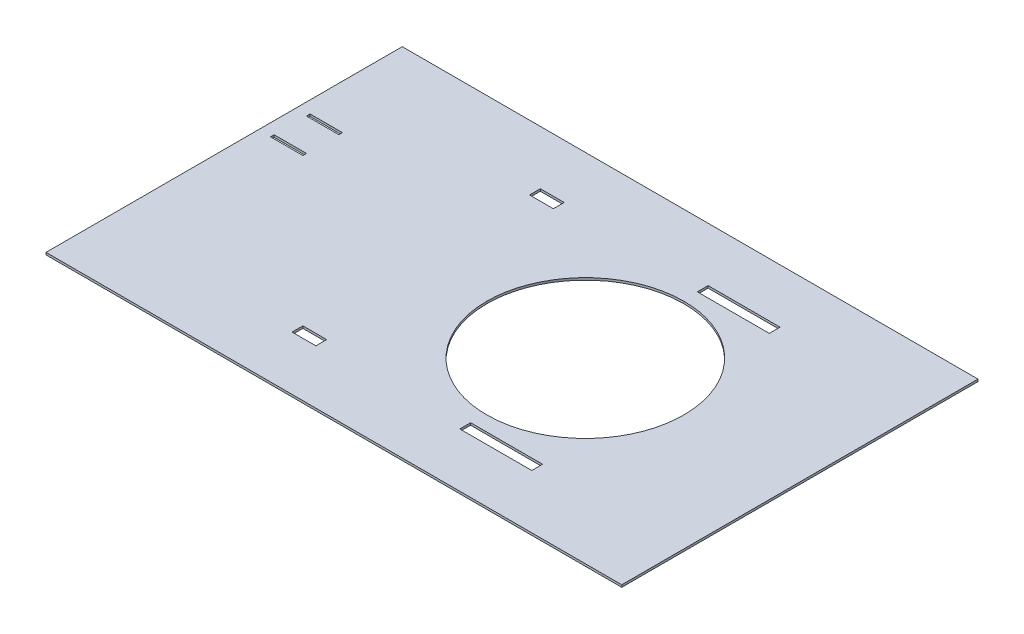
from build123d import *

# Parameters (mm, degrees)
SKETCH1_W           = 774.4075
SKETCH1_H           = 479.1612
SKETCH1_W_2         = 96.8014
SKETCH1_H_2         = 14.5217
SKETCH1_W_3         = 32.0431
SKETCH1_W_4         = 43.5651
SKETCH1_H_3         = 4.8406
SKETCH1_H_4         = 4.8439
SKETCH1_W_5         = 96.7997
BOSS_EXTRUDE1_DEPTH = 3


with BuildPart() as part:
    # Sketch1 → Boss-Extrude1 (new body)
    with BuildSketch(Plane(origin=(0, 0, 0), x_dir=(1, 0, 0), z_dir=(0, 1, 0))):
        Rectangle(SKETCH1_W, SKETCH1_H)
        with Locations((145.20205, -159.71625)):
            Rectangle(SKETCH1_W_2, SKETCH1_H_2, mode=Mode.SUBTRACT)
        with Locations((-112.8262, 159.71955)):
            Rectangle(SKETCH1_W_3, SKETCH1_H_2, mode=Mode.SUBTRACT)
        with Locations((-112.8262, -159.71625)):
            Rectangle(SKETCH1_W_3, SKETCH1_H_2, mode=Mode.SUBTRACT)
        with Locations((-349.0636, 96.8089)):
            Rectangle(SKETCH1_W_4, SKETCH1_H_3, mode=Mode.SUBTRACT)
        with Locations((-349.0636, 48.40155)):
            Rectangle(SKETCH1_W_4, SKETCH1_H_4, mode=Mode.SUBTRACT)
        with Locations((145.1962, 159.71955)):
            Rectangle(SKETCH1_W_5, SKETCH1_H_2, mode=Mode.SUBTRACT)
        with BuildLine():
            add(Edge.make_bspline(
                [(231.14055, 0.003500004), (231.14055, 73.1819), (171.81845, 132.5041), (98.64075, 132.5042)],
                knots=[0, 0, 0, 0, 0.2, 0.2, 0.2, 0.2], degree=3))
            add(Edge.make_bspline(
                [(98.64075, 132.5042), (25.46305, 132.5043), (-33.85925, 73.1822), (-33.85945, 0.0045)],
                knots=[0.2, 0.2, 0.2, 0.2, 0.4, 0.4, 0.4, 0.4], degree=3))
            add(Edge.make_bspline(
                [(-33.85945, 0.0045), (-33.85965, -73.1731), (25.46235, -132.4955), (98.64005, -132.4958)],
                knots=[0.4, 0.4, 0.4, 0.4, 0.6, 0.6, 0.6, 0.6], degree=3))
            add(Edge.make_bspline(
                [(98.64005, -132.4958), (171.81775, -132.4961), (231.14015, -73.1742), (231.14055, 0.003500004)],
                knots=[0.6, 0.6, 0.6, 0.6, 1, 1, 1, 1], degree=3))
        make_face(mode=Mode.SUBTRACT)
    extrude(amount=BOSS_EXTRUDE1_DEPTH)


solid = part.part
